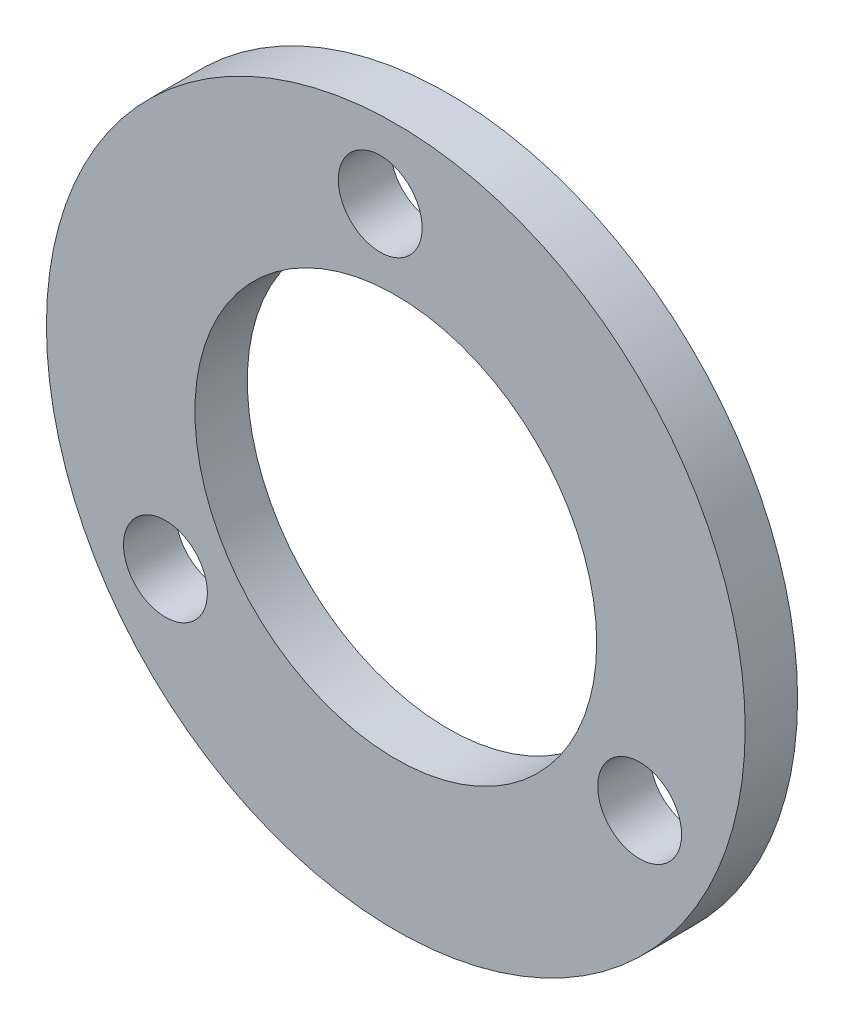
from build123d import *

# Parameters (mm, degrees)
SKETCH2_R           = 20
SKETCH2_R_2         = 2.4
SKETCH2_R_3         = 11.5
BOSS_EXTRUDE1_DEPTH = 3


with BuildPart() as part:
    # Sketch2 → Boss-Extrude1 (new body)
    with BuildSketch(Plane.XY):
        Circle(SKETCH2_R)
        with Locations((-13.184775653, -8.660341037)):
            Circle(SKETCH2_R_2, mode=Mode.SUBTRACT)
        with Locations((13.958150794, -7.065513271)):
            Circle(SKETCH2_R_2, mode=Mode.SUBTRACT)
        Circle(SKETCH2_R_3, mode=Mode.SUBTRACT)
        with Locations((-0.89182915, 15.582825039)):
            Circle(SKETCH2_R_2, mode=Mode.SUBTRACT)
    extrude(amount=BOSS_EXTRUDE1_DEPTH)


solid = part.part
